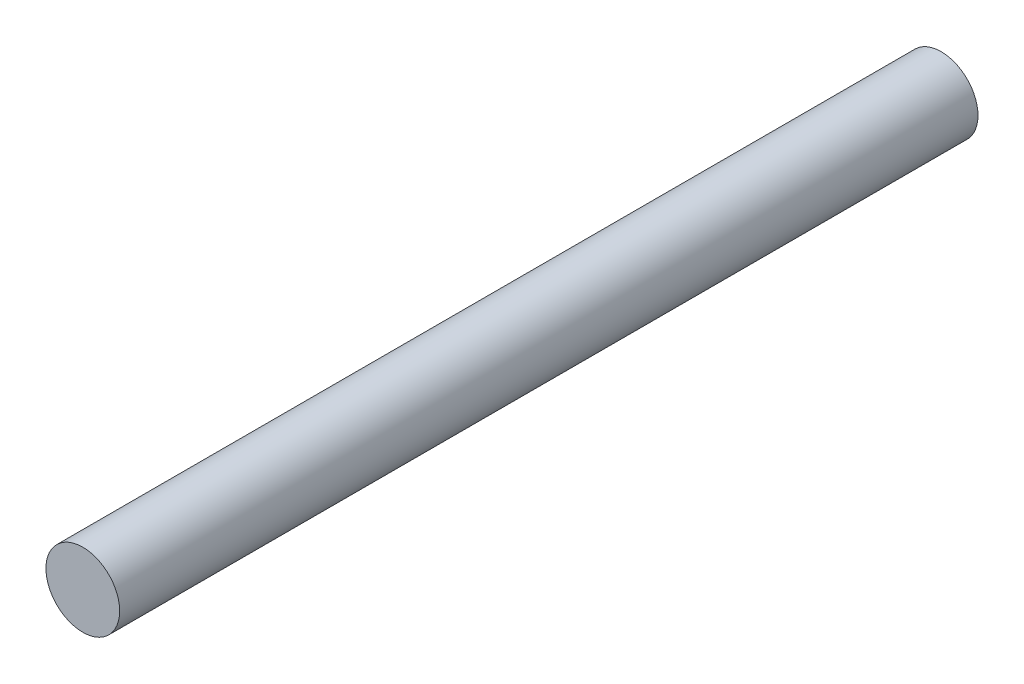
from build123d import *

# Parameters (mm, degrees)
ESQUISSE1_R        = 3
BOSS_EXTRU_1_DEPTH = 69.85


with BuildPart() as part:
    # Esquisse1 → Boss.-Extru.1 (new body)
    with BuildSketch(Plane.XY):
        Circle(ESQUISSE1_R)
    extrude(amount=BOSS_EXTRU_1_DEPTH)


solid = part.part
